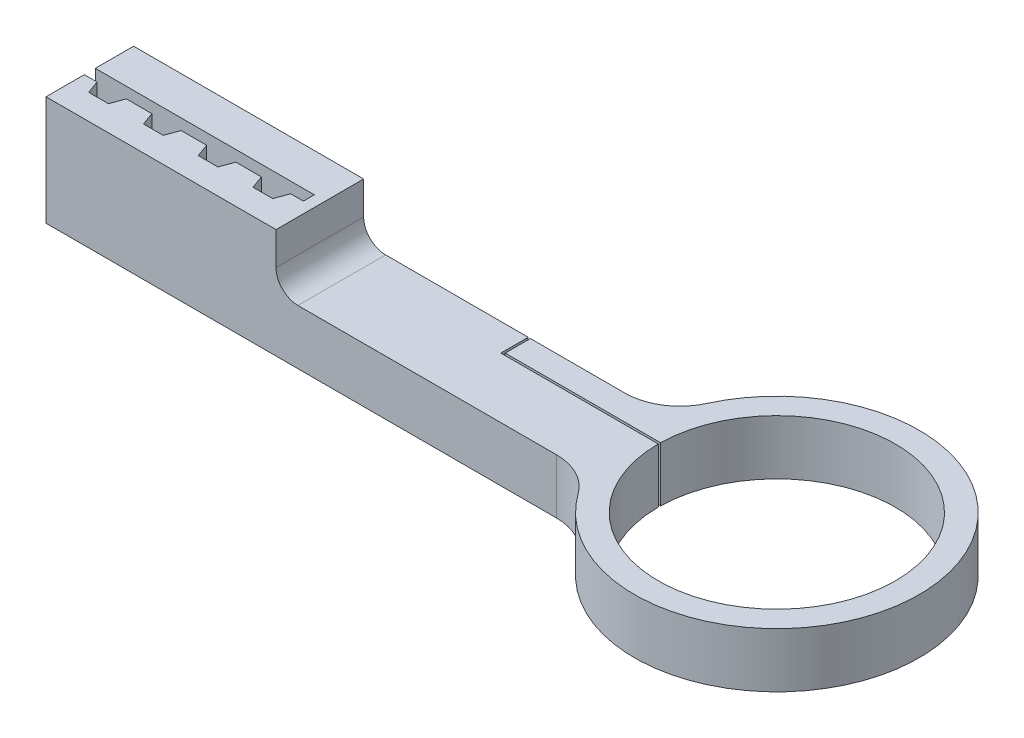
from build123d import *

# Parameters (mm, degrees)
SKETCH_1_R          = 13
SKETCH_1_R_2        = 10.825
RING_DEPTH          = 5
SKETCH_2_W          = 50
SKETCH_2_H          = 8
STICK_DEPTH         = 5
SKETCH_3_W          = 21
SKETCH_3_H          = 8
KEY_DEPTH           = 10
FILLET_1_R          = 5
FILLET_5_R          = 2
KEY_HOLE_DEPTH      = 64.037665059
KEY_HOLE_DEPTH_BACK = 64.037665059
CUT_EXTRUDE_2_DEPTH = 64.3837299


with BuildPart() as part:
    # Эскиз1 → ring (new body)
    with BuildSketch(Plane(origin=(0, 0, 0), x_dir=(1, 0, 0), z_dir=(0, 1, 0))):
        with Locations(Location((0, 0, 0), (0, 0, 270))):
            Circle(SKETCH_1_R)
        with Locations(Location((0, 0, 0), (0, 0, 270))):
            Circle(SKETCH_1_R_2, mode=Mode.SUBTRACT)
    extrude(amount=RING_DEPTH)

    # Эскиз2 → stick (add)
    with BuildSketch(Plane(origin=(0, 0, 0), x_dir=(1, 0, 0), z_dir=(0, 1, 0))):
        with Locations((-36.22497216, -1.5)):
            Rectangle(SKETCH_2_W, SKETCH_2_H)
    extrude(amount=STICK_DEPTH)

    # Эскиз3 → key (add)
    with BuildSketch(Plane(origin=(0, 0, 0), x_dir=(1, 0, 0), z_dir=(0, 1, 0))):
        with Locations((-50.72497216, -1.5)):
            Rectangle(SKETCH_3_W, SKETCH_3_H)
    extrude(amount=KEY_DEPTH)

    # Скругление1
    fillet_1_edges = [part.edges().sort_by_distance(p)[0] for p in [
        (-11.779218989, 2.5, 5.5),
        (-12.757350822, 2.5, -2.5),
    ]]
    fillet(fillet_1_edges, radius=FILLET_1_R)

    # Скругление5
    fillet_5_edges = [part.edges().sort_by_distance(p)[0] for p in [
        (-40.22497216, 5, 1.5),
    ]]
    fillet(fillet_5_edges, radius=FILLET_5_R)

    # Эскиз4 → key hole (cut, two sides: drawn at the far end of the back side and taken through both)
    with BuildSketch(Plane(origin=(0, 2.5, 0), x_dir=(1, 0, 0), z_dir=(0, 1, 0)).offset(-KEY_HOLE_DEPTH_BACK)):
        Polygon((-61.22497216, -1), (-41.22497216, -1), (-41.22497216, -2), (-42.388207879, -2), (-42.82497216, -3.2), (-44.62497216, -3.2), (-45.061736441, -2), (-46.22497216, -2), (-47.388207879, -2), (-47.82497216, -3.2), (-49.62497216, -3.2), (-50.061736441, -2), (-51.22497216, -2), (-52.388207879, -2), (-52.82497216, -3.2), (-54.62497216, -3.2), (-55.061736441, -2), (-56.22497216, -2), (-57.388207879, -2), (-57.82497216, -3.2), (-59.62497216, -3.2), (-60.061736441, -2), (-61.22497216, -2), align=None)
    extrude(amount=KEY_HOLE_DEPTH + KEY_HOLE_DEPTH_BACK, mode=Mode.SUBTRACT)

    # Эскиз5 → Вытянуть2 (cut, through all)
    with BuildSketch(Plane.XZ):
        Polygon((-25.2, -2.5), (-25.2, 0), (0, 0), (0, -0.2), (-25, -0.2), (-25, -2.5), align=None)
    extrude(amount=-CUT_EXTRUDE_2_DEPTH, mode=Mode.SUBTRACT)


solid = part.part
